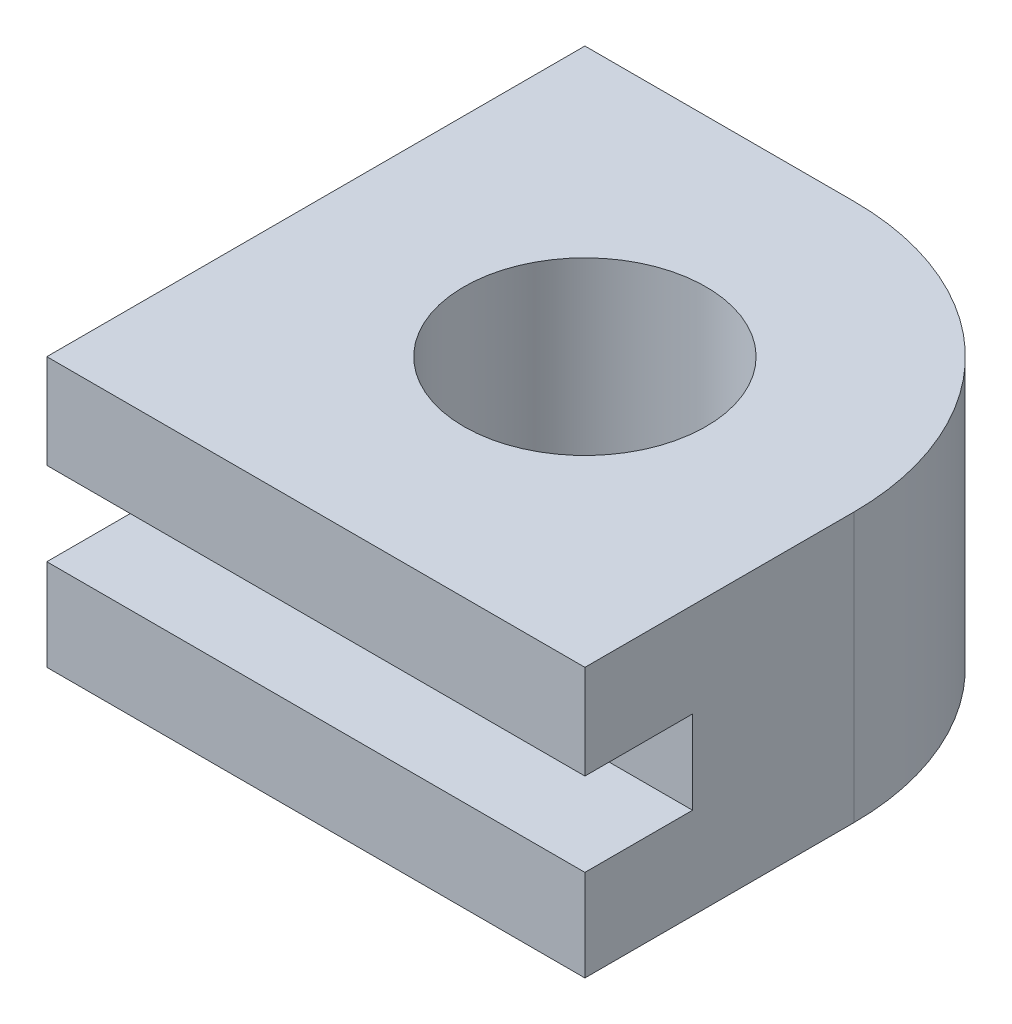
from build123d import *

# Parameters (mm, degrees)
SKETCH1_W           = 10
SKETCH1_H           = 10
SKETCH1_R           = 2.25
BOSS_EXTRUDE1_DEPTH = 5
CUT_EXTRUDE1_START  = -1.75
CUT_EXTRUDE1_DEPTH  = 1.55
FILLET1_R           = 5


with BuildPart() as part:
    # Sketch1 → Boss-Extrude1 (new body)
    with BuildSketch(Plane(origin=(0, 0, 0), x_dir=(1, 0, 0), z_dir=(0, 1, 0))):
        Rectangle(SKETCH1_W, SKETCH1_H)
        with Locations(Location((0, 0, 0), (0, 0, 270))):
            Circle(SKETCH1_R, mode=Mode.SUBTRACT)
    extrude(amount=BOSS_EXTRUDE1_DEPTH)

    # Sketch2 → Cut-Extrude1 (cut)
    with BuildSketch(Plane(origin=(0, 5, 0), x_dir=(1, 0, 0), z_dir=(0, 1, 0)).offset(CUT_EXTRUDE1_START)):
        Polygon((-3, 5), (-5, 5), (-5, -5), (5, -5), (5, -3), (-3, -3), align=None)
    extrude(amount=-CUT_EXTRUDE1_DEPTH, mode=Mode.SUBTRACT)

    # Fillet1
    fillet1_edges = [part.edges().sort_by_distance(p)[0] for p in [
        (5, 2.5, -5),
    ]]
    fillet(fillet1_edges, radius=FILLET1_R)


solid = part.part
